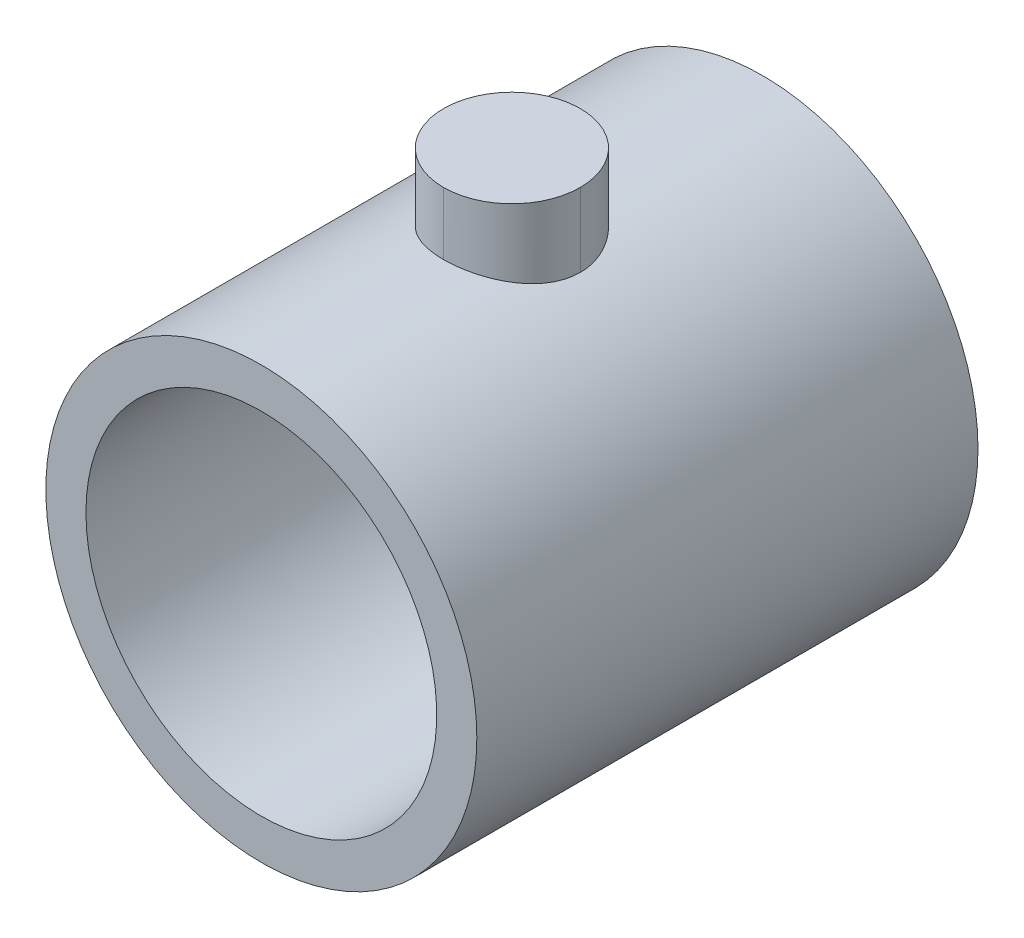
from build123d import *

# Parameters (mm, degrees)
SKETCH1_R                = 21.5
BOSS_EXTRUDE1_DEPTH      = 50
SKETCH2_R                = 17.5
CUT_EXTRUDE1_DEPTH       = 495.985656358
BOSS_EXTRUDE2_REACH      = 750.708
BOSS_EXTRUDE2_END_RADIUS = 21.5


with BuildPart() as part:
    # Sketch1 → Boss-Extrude1 (new body)
    with BuildSketch(Plane(origin=(0, 0, 624.8), x_dir=(-1, 0, 0), z_dir=(0, 0, -1))):
        with Locations(Location((299.1, 352.3, 0), (0, 0, 180))):
            Circle(SKETCH1_R)
    extrude(amount=-BOSS_EXTRUDE1_DEPTH)

    # Sketch2 → Cut-Extrude1 (cut, through all)
    with BuildSketch(Plane.XY.offset(674.8)):
        with Locations(Location((-299.1, 352.3, 0), (0, 0, 180))):
            Circle(SKETCH2_R)
    extrude(amount=-CUT_EXTRUDE1_DEPTH, mode=Mode.SUBTRACT)

    # Boss-Extrude2: up to this cylinder (the profile starts outside it)
    boss_extrude2_end = Plane(origin=(-299.1, 352.3, 649.8), z_dir=(0, 0, -1)) * Cylinder(BOSS_EXTRUDE2_END_RADIUS, 1545.416, mode=Mode.PRIVATE)
    # Sketch3 → Boss-Extrude2 (add, up to the surface)
    with BuildSketch(Plane(origin=(0, 380.036620923, 0), x_dir=(1, 0, 0), z_dir=(0, 1, 0)), mode=Mode.PRIVATE) as boss_extrude2_sk1:
        with BuildLine():
            ThreePointArc((-292.280237329, -649.8), (-294.277699569, -654.622300431), (-299.1, -656.619762671))
            ThreePointArc((-299.1, -656.619762671), (-303.922300431, -644.977699569), (-292.280237329, -649.8))
        make_face()
    boss_extrude2_tool1 = extrude(boss_extrude2_sk1.sketch, amount=-BOSS_EXTRUDE2_REACH, mode=Mode.PRIVATE) - boss_extrude2_end
    add(boss_extrude2_tool1.solids().sort_by_distance((-299.1, 380.036621, 649.8))[0])


solid = part.part
